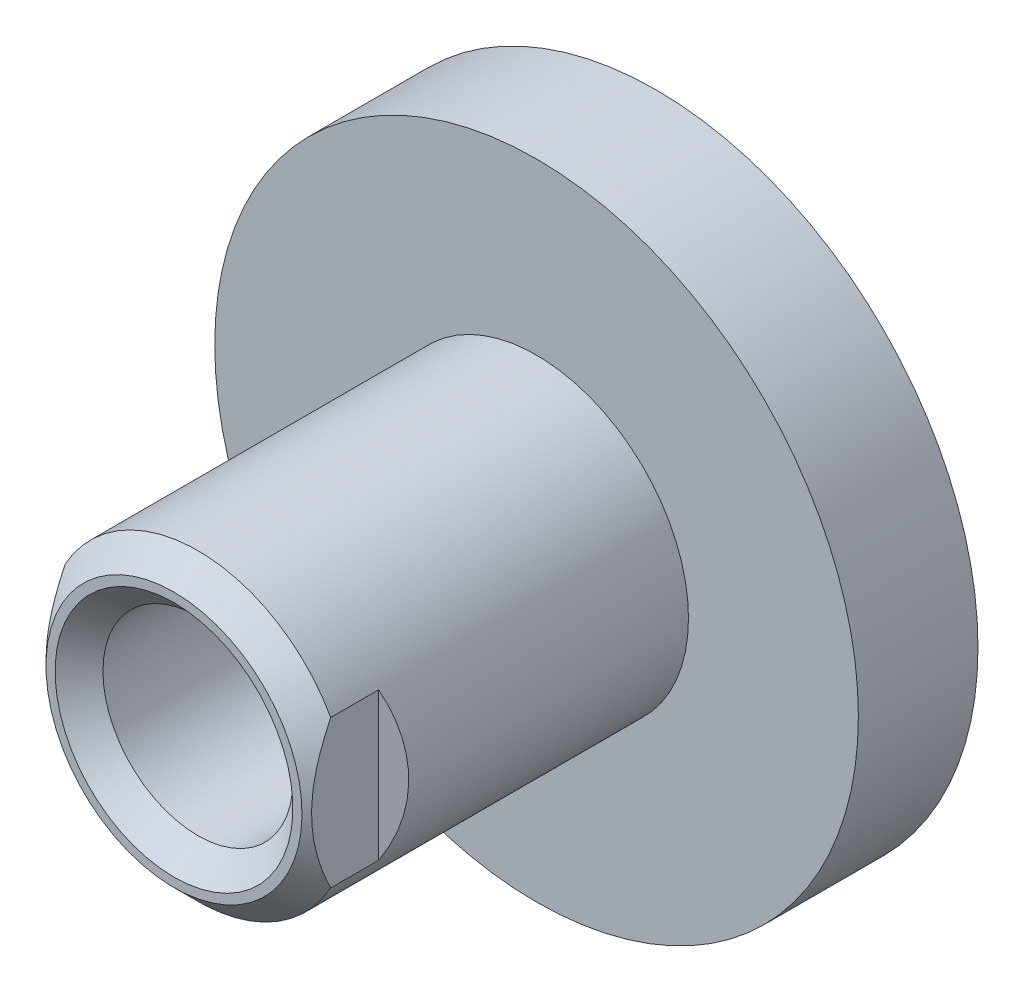
from build123d import *

# Parameters (mm, degrees)
SKETCH1_R                                 = 13.45
PISTON_DEPTH                              = 5
SKETCH2_R                                 = 6.35
ROD_DEPTH                                 = 20.153
F_106_5_16_24_INTERNAL_THREAD_D           = 6.9088
F_106_5_16_24_INTERNAL_THREAD_DEPTH       = 16.37754
F_106_5_16_24_INTERNAL_THREAD_CBORE_D     = 7.9375
F_106_5_16_24_INTERNAL_THREAD_CBORE_DEPTH = 13.208
F_106_5_16_24_INTERNAL_THREAD_TIP         = 2.075612922
ROD_END_CHAMFER_SIZE                      = 1
WRENCH_FLATS_DEPTH                        = 28.711882091
WRENCH_FLATS_DEPTH_BACK                   = 28.711882091


with BuildPart() as part:
    # Sketch1 → Piston (new body)
    with BuildSketch(Plane.XY):
        Circle(SKETCH1_R)
    extrude(amount=PISTON_DEPTH)

    # Sketch2 → Rod (add)
    with BuildSketch(Plane(origin=(0, 0, 0), x_dir=(-1, 0, 0), z_dir=(0, 0, -1))):
        with Locations(Location((0, 0, 0), (0, 0, 90))):
            Circle(SKETCH2_R)
    extrude(amount=-ROD_DEPTH)

    # 106 5/16-24 Internal Thread
    with Locations(Plane(origin=(0, 0, 20.153), x_dir=(0, 1, 0), z_dir=(0, 0, 1))):
        with Locations((0, 0)):
            CounterBoreHole(F_106_5_16_24_INTERNAL_THREAD_D / 2, F_106_5_16_24_INTERNAL_THREAD_CBORE_D / 2, F_106_5_16_24_INTERNAL_THREAD_CBORE_DEPTH, depth=F_106_5_16_24_INTERNAL_THREAD_DEPTH)
            with Locations((0, 0, -(F_106_5_16_24_INTERNAL_THREAD_DEPTH + F_106_5_16_24_INTERNAL_THREAD_TIP / 2))):  # 118° drill point
                Cone(0, F_106_5_16_24_INTERNAL_THREAD_D / 2, F_106_5_16_24_INTERNAL_THREAD_TIP, mode=Mode.SUBTRACT)

    # Rod End Chamfer
    rod_end_chamfer_edges = [part.edges().sort_by_distance(p)[0] for p in [
        (0, -3.96875, 20.153),
        (0, -6.35, 20.153),
    ]]
    chamfer(rod_end_chamfer_edges, length=ROD_END_CHAMFER_SIZE)

    # Sketch11 → Wrench Flats (cut, two sides: drawn at the far end of the back side and taken through both)
    with BuildSketch(Plane(origin=(0, 0, 0), x_dir=(1, 0, 0), z_dir=(0, 1, 0)).offset(-WRENCH_FLATS_DEPTH_BACK)):
        Polygon((-5.55, -20.153), (-5.55, -17.153), (-10.55, -14.266248654), (-10.55, -20.153), align=None)
        Polygon((5.55, -20.153), (5.55, -17.153), (10.55, -14.266248654), (10.55, -20.153), align=None)
    extrude(amount=WRENCH_FLATS_DEPTH + WRENCH_FLATS_DEPTH_BACK, mode=Mode.SUBTRACT)


solid = part.part
